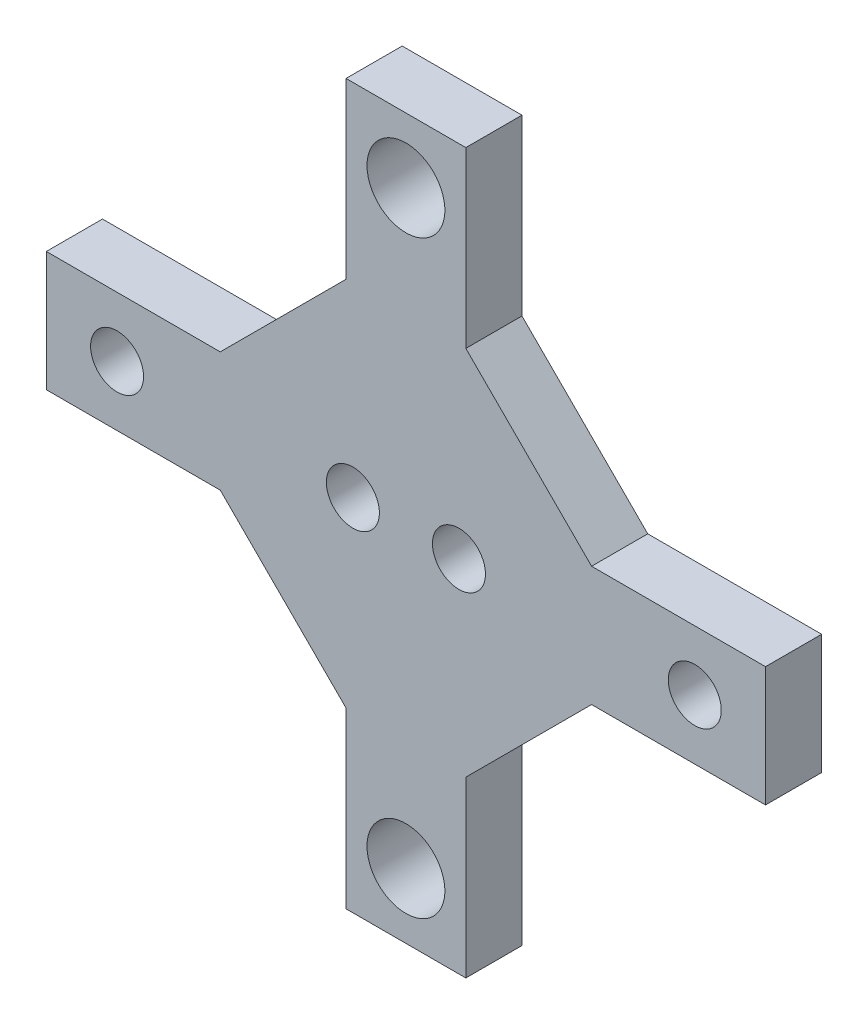
from build123d import *

# Parameters (mm, degrees)
BOSS_EXTRUDE5_DEPTH = 4.7625
BOSS_EXTRUDE6_DEPTH = 4.7625


with BuildPart() as part:
    # Sketch1 → Boss-Extrude5 (new body)
    with BuildSketch(Plane.XY):
        with BuildLine():
            Line((0, 28.302), (0, 30.5))
            Line((0, 30.5), (-5.08, 30.5))
            Line((-5.08, 30.5), (-5.08, 5.08))
            Line((-5.08, 5.08), (0, 5.08))
            Line((0, 5.08), (0, 21.698))
            ThreePointArc((0, 21.698), (-3.302, 25), (0, 28.302))
        make_face()
        with BuildLine():
            Line((5.08, 30.5), (0, 30.5))
            Line((0, 30.5), (0, 28.302))
            ThreePointArc((0, 28.302), (2.334866591, 27.334866591), (3.302, 25))
            ThreePointArc((3.302, 25), (2.334866591, 22.665133409), (0, 21.698))
            Line((0, 21.698), (0, 5.08))
            Line((0, 5.08), (5.08, 5.08))
            Line((5.08, 5.08), (5.08, 30.5))
        make_face()
        with BuildLine():
            Line((30.5, 5.08), (5.08, 5.08))
            Line((5.08, 5.08), (5.08, 2.171785995))
            ThreePointArc((5.08, 2.171785995), (6.282811882, 1.369173548), (6.7479, 0))
            Line((6.7479, 0), (22.2521, 0))
            ThreePointArc((22.2521, 0), (24.5, 2.2479), (26.7479, 0))
            Line((26.7479, 0), (30.5, 0))
            Line((30.5, 0), (30.5, 5.08))
        make_face()
        with BuildLine():
            Line((22.2521, 0), (6.7479, 0))
            ThreePointArc((6.7479, 0), (6.282811882, -1.369173548), (5.08, -2.171785995))
            Line((5.08, -2.171785995), (5.08, -5.08))
            Line((5.08, -5.08), (30.5, -5.08))
            Line((30.5, -5.08), (30.5, 0))
            Line((30.5, 0), (26.7479, 0))
            ThreePointArc((26.7479, 0), (24.5, -2.2479), (22.2521, 0))
        make_face()
        with BuildLine():
            Line((2.2521, 0), (0, 0))
            Line((0, 0), (0, -5.08))
            Line((0, -5.08), (5.08, -5.08))
            Line((5.08, -5.08), (5.08, -2.171785995))
            ThreePointArc((5.08, -2.171785995), (3.130826452, -1.782811882), (2.2521, 0))
        make_face()
        with BuildLine():
            Line((0, -5.08), (0, 0))
            Line((0, 0), (-2.2521, 0))
            ThreePointArc((-2.2521, 0), (-3.130826452, -1.782811882), (-5.08, -2.171785995))
            Line((-5.08, -2.171785995), (-5.08, -5.08))
            Line((-5.08, -5.08), (0, -5.08))
        make_face()
        with BuildLine():
            Line((5.08, 2.171785995), (5.08, 5.08))
            Line((5.08, 5.08), (0, 5.08))
            Line((0, 5.08), (0, 0))
            Line((0, 0), (2.2521, 0))
            ThreePointArc((2.2521, 0), (3.130826452, 1.782811882), (5.08, 2.171785995))
        make_face()
        with BuildLine():
            Line((0, 5.08), (-5.08, 5.08))
            Line((-5.08, 5.08), (-5.08, 2.171785995))
            ThreePointArc((-5.08, 2.171785995), (-3.130826452, 1.782811882), (-2.2521, 0))
            Line((-2.2521, 0), (0, 0))
            Line((0, 0), (0, 5.08))
        make_face()
        with BuildLine():
            Line((-5.08, 2.171785995), (-5.08, 5.08))
            Line((-5.08, 5.08), (-30.5, 5.08))
            Line((-30.5, 5.08), (-30.5, 0))
            Line((-30.5, 0), (-26.7479, 0))
            ThreePointArc((-26.7479, 0), (-24.5, 2.2479), (-22.2521, 0))
            Line((-22.2521, 0), (-6.7479, 0))
            ThreePointArc((-6.7479, 0), (-6.282811882, 1.369173548), (-5.08, 2.171785995))
        make_face()
        with BuildLine():
            ThreePointArc((-5.08, -2.171785995), (-6.282811882, -1.369173548), (-6.7479, 0))
            Line((-6.7479, 0), (-22.2521, 0))
            ThreePointArc((-22.2521, 0), (-24.5, -2.2479), (-26.7479, 0))
            Line((-26.7479, 0), (-30.5, 0))
            Line((-30.5, 0), (-30.5, -5.08))
            Line((-30.5, -5.08), (-5.08, -5.08))
            Line((-5.08, -5.08), (-5.08, -2.171785995))
        make_face()
        with BuildLine():
            Line((0, -21.698), (0, -5.08))
            Line((0, -5.08), (-5.08, -5.08))
            Line((-5.08, -5.08), (-5.08, -30.5))
            Line((-5.08, -30.5), (0, -30.5))
            Line((0, -30.5), (0, -28.302))
            ThreePointArc((0, -28.302), (-3.302, -25), (0, -21.698))
        make_face()
        with BuildLine():
            Line((5.08, -5.08), (0, -5.08))
            Line((0, -5.08), (0, -21.698))
            ThreePointArc((0, -21.698), (2.334866591, -22.665133409), (3.302, -25))
            ThreePointArc((3.302, -25), (2.334866591, -27.334866591), (0, -28.302))
            Line((0, -28.302), (0, -30.5))
            Line((0, -30.5), (5.08, -30.5))
            Line((5.08, -30.5), (5.08, -5.08))
        make_face()
    extrude(amount=BOSS_EXTRUDE5_DEPTH)

    # Sketch3 → Boss-Extrude6 (add)
    with BuildSketch(Plane.XY.offset(4.7625)):
        Polygon((5.08, 5.08), (15.748, 5.08), (5.08, 15.748), align=None)
        Polygon((5.08, -5.08), (5.08, -15.748), (15.748, -5.08), align=None)
        Polygon((-5.08, -5.08), (-15.748, -5.08), (-5.08, -15.748), align=None)
        Polygon((-15.748, 5.08), (-5.08, 5.08), (-5.08, 15.748), align=None)
    extrude(amount=-BOSS_EXTRUDE6_DEPTH)


solid = part.part
